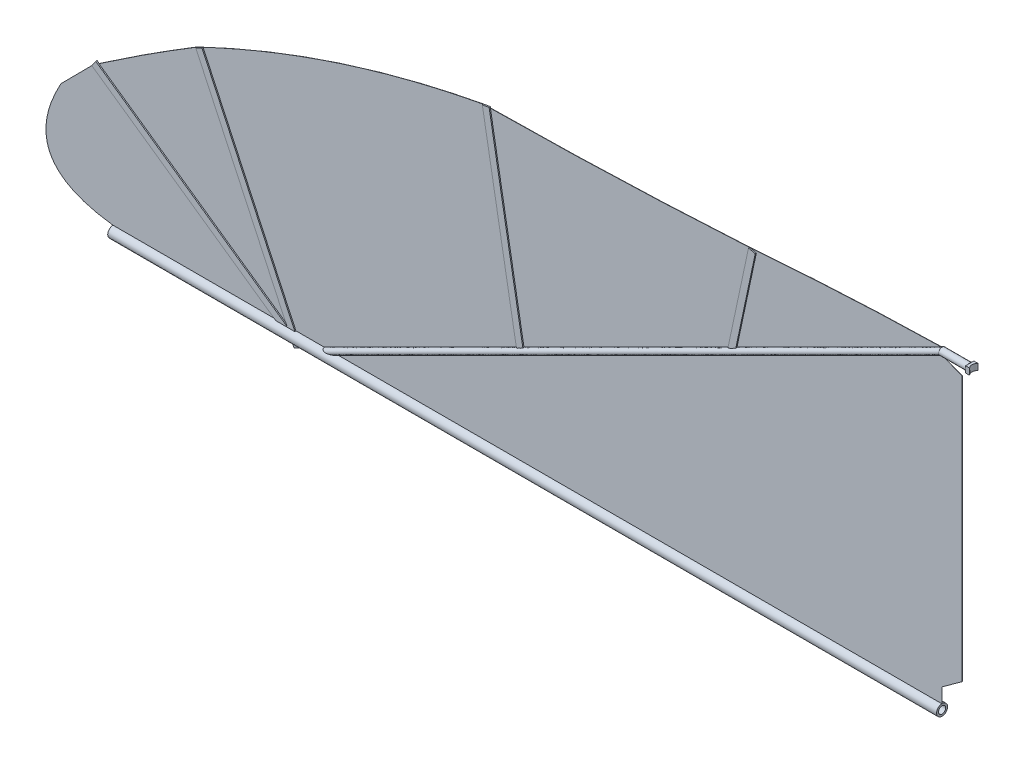
from build123d import *

# Parameters (mm, degrees)
SKETCH2_R            = 4
SKETCH2_R_2          = 2.6
SKETCH4_R            = 2.5
BOSS_EXTRUDE1_DEPTH  = 0.2
EXTRUDE_THIN1_DEPTH  = 1
BOSS_EXTRUDE5_DEPTH  = 0.2
BOSS_EXTRUDE8_DEPTH  = 0.2
SKETCH9_R            = 2.5
BOSS_EXTRUDE9_DEPTH  = 20
SKETCH13_W           = 6
SKETCH13_H           = 4.552968098
BOSS_EXTRUDE11_DEPTH = 3
CUT_EXTRUDE2_DEPTH   = 22


with BuildPart() as part:
    # Sweep1: sweep along a path in Sketch1
    with BuildLine(Plane.XY) as sweep1_path:
        Line((-300, 0), (300, 0))
    # Sketch2 → Sweep1 (sweep)
    with BuildSketch(Plane(origin=(-300, 0, 0), x_dir=(0, 0, -1), z_dir=(1, 0, 0))):
        Circle(SKETCH2_R)
        Circle(SKETCH2_R_2, mode=Mode.SUBTRACT)
    sweep(path=sweep1_path.line)

    # Sweep2: sweep along a path in Sketch3
    with BuildLine(Plane.XY) as sweep2_path:
        Line((-150, 0), (300, 225))
    # Sketch4 → Sweep2 (sweep)
    with BuildSketch(Plane(origin=(300, 0, 0), x_dir=(0, 0, -1), z_dir=(1, 0, 0))):
        with Locations((0, 225)):
            Circle(SKETCH4_R)
    sweep(path=sweep2_path.line)

    # Sketch9 → Boss-Extrude9 (add)
    with BuildSketch(Plane(origin=(300, 0, 0), x_dir=(0, 0, -1), z_dir=(1, 0, 0))):
        with Locations((0, 225)):
            Circle(SKETCH9_R)
    extrude(amount=BOSS_EXTRUDE9_DEPTH)

    # Sketch13 → Boss-Extrude11 (add)
    with BuildSketch(Plane(origin=(320, 0, 0), x_dir=(0, 0, -1), z_dir=(1, 0, 0))):
        with Locations((0, 225)):
            Rectangle(SKETCH13_W, SKETCH13_H)
    extrude(amount=BOSS_EXTRUDE11_DEPTH)

    # Sketch14 → Cut-Extrude2 (cut)
    with BuildSketch(Plane.XZ.offset(-222.723515951)):
        with BuildLine():
            Line((323, -3), (323, 3))
            ThreePointArc((323, 3), (321.645751311, 0), (323, -3))
        make_face()
    extrude(amount=-CUT_EXTRUDE2_DEPTH, mode=Mode.SUBTRACT)


with BuildPart() as body_2:
    # Sketch5 → Boss-Extrude1 (new body)
    with BuildSketch(Plane.XY):
        with BuildLine():
            Line((-147, 4), (300, 227.5))
            add(Edge.make_bspline(
                [(160.862053395, 220.491547039), (230.326804025, 226.024459276), (300, 227.5)],
                knots=[0, 0, 0, 1, 1, 1], degree=2))
            add(Edge.make_bspline(
                [(-31.829568459, 213.92810442), (64.59402736, 214.756003993), (160.862053395, 220.491547039)],
                knots=[0, 0, 0, 1, 1, 1], degree=2))
            add(Edge.make_bspline(
                [(-239.297538389, 146), (-140.160075695, 193.72922093), (-31.829568459, 213.92810442)],
                knots=[0, 0, 0, 1, 1, 1], degree=2))
            add(Edge.make_bspline(
                [(-314.548938061, 97.192973499), (-277.625079571, 122.680840467), (-239.297538389, 146)],
                knots=[0, 0, 0, 1, 1, 1], degree=2))
            Line((-314.548938061, 97.192973499), (-337.63227676, 73.92810442))
            add(Edge.make_bspline(
                [(-300, 4), (-371.476306472, 12.609395253), (-337.63227676, 73.92810442)],
                knots=[0, 0, 0, 1, 1, 1], degree=2))
            Line((-300, 4), (-147, 4))
        make_face()
    extrude(amount=BOSS_EXTRUDE1_DEPTH)

    # Sketch5<3> → Extrude-Thin1 (add)
    with BuildSketch(Plane.XY):
        Polygon((-167.101570089, -6.050785045), (-314.548938061, 97.192973499), (-311.681055879, 101.28873372), (-164.233687907, -1.955024823), align=None)
        Polygon((-168.150525033, -6.575262516), (-239.297538389, 146), (-234.765999454, 148.113091309), (-163.618986098, -4.462171208), align=None)
        Polygon((-7.14379116, 73.92810442), (-31.829568459, 213.92810442), (-26.905529694, 214.796345309), (-2.219752395, 74.796345309), align=None)
        Polygon((145.983094078, 150.491547039), (160.862053395, 220.491547039), (165.752791399, 219.451988585), (150.873832082, 149.451988585), align=None)
    extrude(amount=EXTRUDE_THIN1_DEPTH)


with BuildPart() as body_3:
    # Sketch6 → Boss-Extrude5 (new body)
    with BuildSketch(Plane.XY):
        Polygon((300, 4), (300, 222.5), (-137, 4), align=None)
    extrude(amount=BOSS_EXTRUDE5_DEPTH)

    # Sketch8 → Boss-Extrude8 (add)
    with BuildSketch(Plane.XY):
        Polygon((314.67349594, 216.981159788), (300, 222.5), (300, 14.513908711), (314.67349594, 25.150660034), align=None)
    extrude(amount=BOSS_EXTRUDE8_DEPTH)


solid = Compound([part.part, body_2.part, body_3.part])
